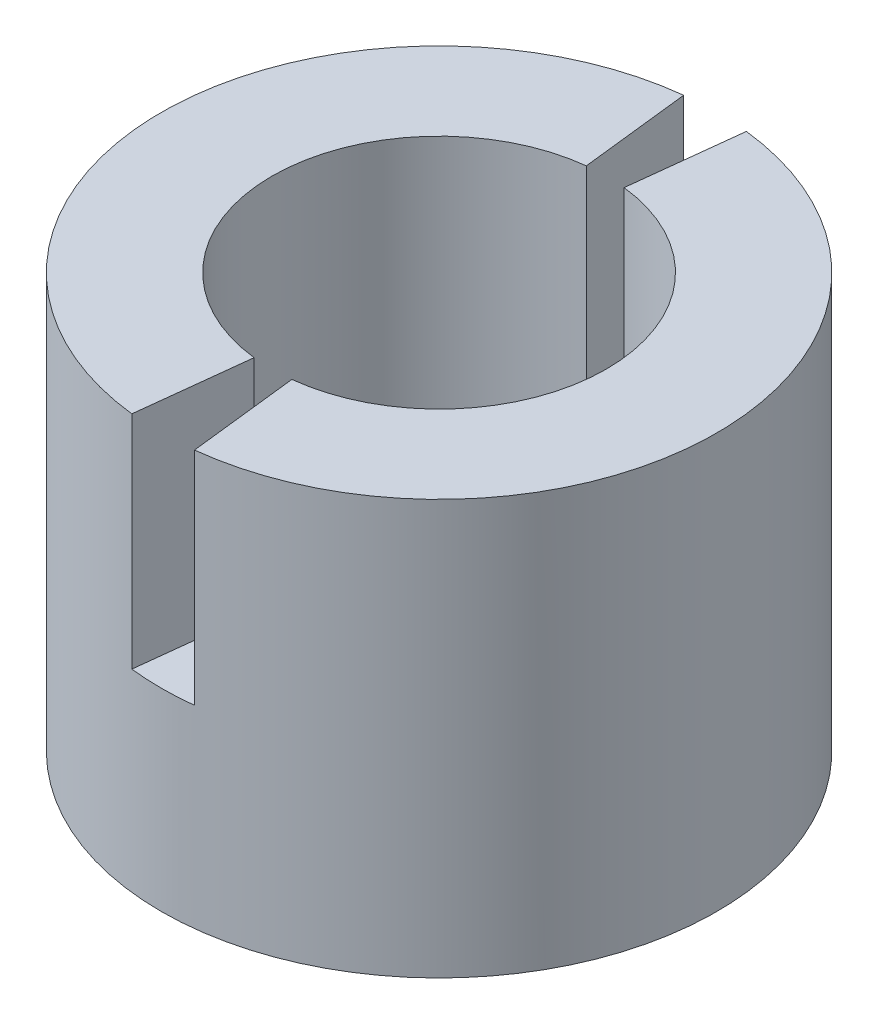
from build123d import *

# Parameters (mm, degrees)
SKETCH1_R           = 10.05
SKETCH1_R_2         = 6.05
BOSS_EXTRUDE1_DEPTH = 15
CUT_EXTRUDE2_DEPTH  = 8


with BuildPart() as part:
    # Sketch1 → Boss-Extrude1 (new body)
    with BuildSketch(Plane(origin=(0, 0, 0), x_dir=(1, 0, 0), z_dir=(0, 1, 0))):
        with Locations(Location((0, 0, 0), (0, 0, 270))):
            Circle(SKETCH1_R)
        with Locations(Location((0, 0, 0), (0, 0, 270))):
            Circle(SKETCH1_R_2, mode=Mode.SUBTRACT)
    extrude(amount=BOSS_EXTRUDE1_DEPTH)

    # Sketch6 → Cut-Extrude2 (cut)
    with BuildSketch(Plane(origin=(0, 15, 0), x_dir=(1, 0, 0), z_dir=(0, 1, 0))):
        Polygon((-0.637272671, 5.61077026), (0.637272671, 5.61077026), (1.215708589, 10.703521268), (-1.215708589, 10.703521268), align=None)
        Polygon((-0.637272671, -5.61077026), (-1.215708589, -10.703521268), (1.215708589, -10.703521268), (0.637272671, -5.61077026), align=None)
    extrude(amount=-CUT_EXTRUDE2_DEPTH, mode=Mode.SUBTRACT)


solid = part.part
